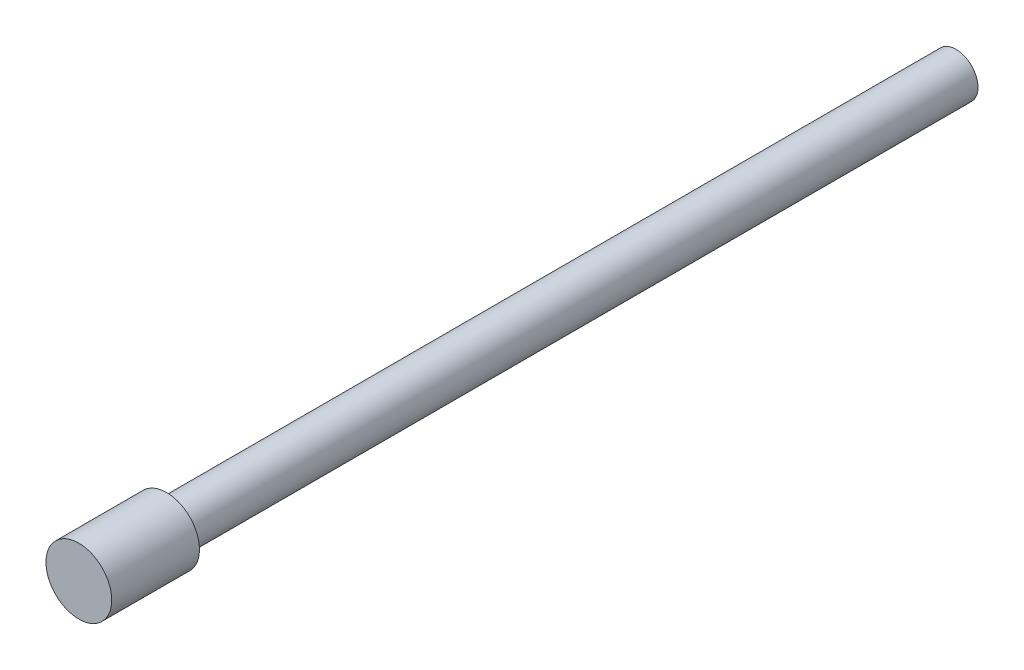
from build123d import *

# Parameters (mm, degrees)
ESBO_O1_R                = 7.5
RESSALTO_EXTRUS_O1_DEPTH = 20
ESBO_O9_R                = 5
RESSALTO_EXTRUS_O3_DEPTH = 180


with BuildPart() as part:
    # Esboço1 → Ressalto-extrusão1 (new body)
    with BuildSketch(Plane.XY):
        Circle(ESBO_O1_R)
    extrude(amount=-RESSALTO_EXTRUS_O1_DEPTH)

    # Esboço9 → Ressalto-extrusão3 (add)
    with BuildSketch(Plane(origin=(0, 0, -20), x_dir=(-1, 0, 0), z_dir=(0, 0, -1))):
        with Locations(Location((0, 0, 0), (0, 0, 180))):
            Circle(ESBO_O9_R)
    extrude(amount=RESSALTO_EXTRUS_O3_DEPTH)


solid = part.part
